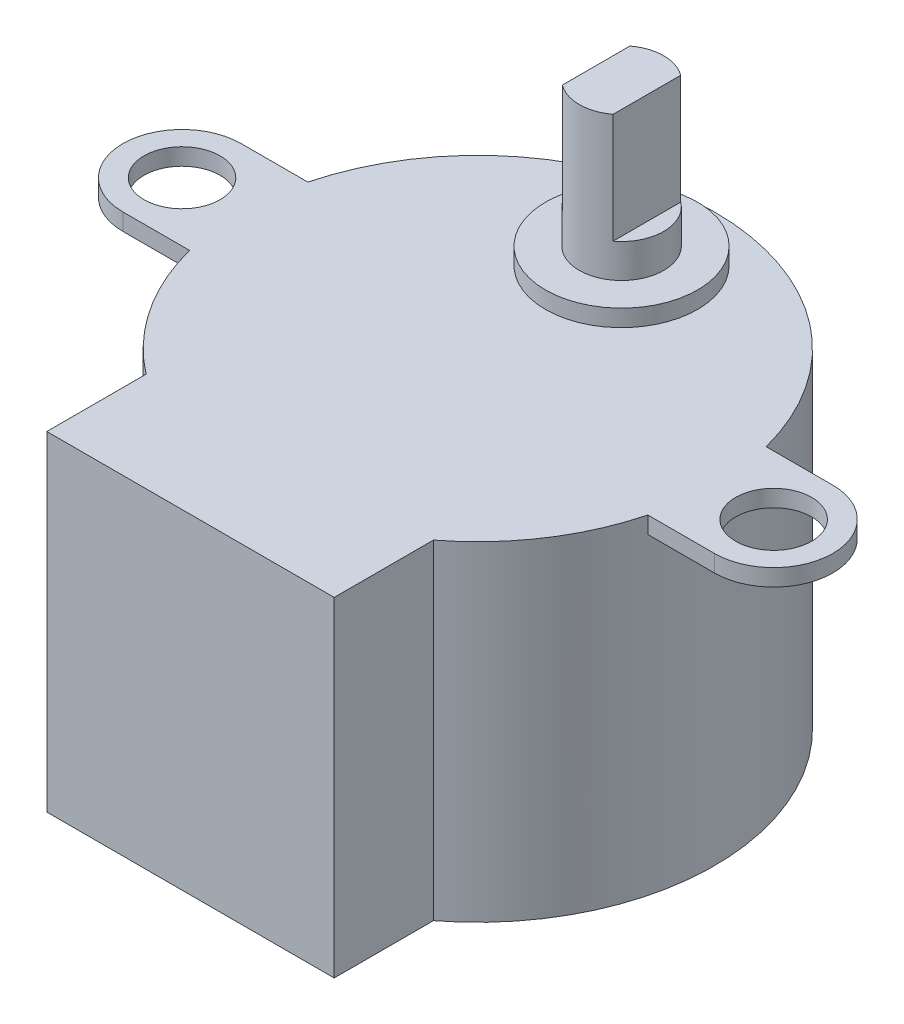
from build123d import *

# Parameters (mm, degrees)
BOSS_EXTRUDE1_DEPTH = 19.5
BOSS_EXTRUDE2_START = 18.5
SKETCH2_3_R         = 2.250000000000002
SKETCH2_3_R_2       = 2.249999999999999
BOSS_EXTRUDE2_DEPTH = 1
BOSS_EXTRUDE3_START = 19.5
SKETCH2_4_R         = 4.5
SKETCH2_4_R_2       = 2.5000000000000004
SKETCH2_4_W         = 3
SKETCH2_4_H         = 3.9999999999999973
BOSS_EXTRUDE3_DEPTH = 1
BOSS_EXTRUDE4_START = 20.5
SKETCH2_5_W         = 3
SKETCH2_5_H         = 3.9999999999999973
BOSS_EXTRUDE4_DEPTH = 2
BOSS_EXTRUDE5_START = 22.5
SKETCH2_6_W         = 3
SKETCH2_6_H         = 3.9999999999999973
BOSS_EXTRUDE5_DEPTH = 6.5


with BuildPart() as part:
    # Sketch2 → Boss-Extrude1 (new body)
    with BuildSketch(Plane(origin=(0, 0, 0), x_dir=(1, 0, 0), z_dir=(0, 1, 0))):
        with BuildLine():
            Line((-8.500000000000002, -17), (8.499999999999998, -17))
            Line((8.499999999999998, -17), (8.499999999999998, -11.124297730643494))
            ThreePointArc((8.5, -11.124297730643494), (0, 14), (-8.5, -11.124297730643493))
            Line((-8.500000000000002, -11.124297730643494), (-8.500000000000002, -17))
        make_face()
    extrude(amount=BOSS_EXTRUDE1_DEPTH)

    # Sketch2<3> → Boss-Extrude2 (add)
    # profile 1 of 2: a face of its own
    with BuildSketch(Plane(origin=(0, 0, 0), x_dir=(1, 0, 0), z_dir=(0, 1, 0)).offset(BOSS_EXTRUDE2_START)):
        with BuildLine():
            Line((13.555441711725987, -3.4999999999999996), (17.5, -3.499999999999999))
            ThreePointArc((17.5, -3.5), (21, -2.4e-16), (17.5, 3.5))
            Line((17.5, 3.499999999999999), (13.555441711725718, 3.4999999999999987))
            ThreePointArc((13.555441711725832, 3.5000000000004934), (13.999999999999998, 2.8244e-13), (13.555441711725974, -3.4999999999999454))
        make_face()
        with Locations(Location((17.5, -3e-17, 0), (0, 0, 270))):
            Circle(SKETCH2_3_R, mode=Mode.SUBTRACT)
    # profile 2 of 2: a face of its own
    with BuildSketch(Plane(origin=(0, 0, 0), x_dir=(1, 0, 0), z_dir=(0, 1, 0)).offset(BOSS_EXTRUDE2_START)):
        with BuildLine():
            Line((-17.499999999999986, -3.5000000000000044), (-13.555441711725983, -3.500000000000004))
            ThreePointArc((-13.555441711725972, -3.4999999999999547), (-14.000000000000002, 2.7667e-13), (-13.555441711725834, 3.50000000000049))
            Line((-13.55544171172572, 3.499999999999996), (-17.499999999999986, 3.4999999999999956))
            ThreePointArc((-17.499999999999986, 3.4999999999999956), (-20.999999999999986, -3.91e-15), (-17.499999999999986, -3.5000000000000044))
        make_face()
        with Locations(Location((-17.499999999999986, -4.34e-15, 0), (0, 0, 270))):
            Circle(SKETCH2_3_R_2, mode=Mode.SUBTRACT)
    extrude(amount=BOSS_EXTRUDE2_DEPTH)

    # Sketch2<4> → Boss-Extrude3 (add)
    # profile 1 of 6: a face of its own
    with BuildSketch(Plane(origin=(0, 0, 0), x_dir=(1, 0, 0), z_dir=(0, 1, 0)).offset(BOSS_EXTRUDE3_START)):
        with Locations(Location((0, 8.5, 0), (0, 0, 270))):
            Circle(SKETCH2_4_R)
        with Locations((0, 8.5)):
            Circle(SKETCH2_4_R_2, mode=Mode.SUBTRACT)
    # profile 2 of 6: a face of its own
    with BuildSketch(Plane(origin=(0, 0, 0), x_dir=(1, 0, 0), z_dir=(0, 1, 0)).offset(BOSS_EXTRUDE3_START)):
        with Locations((0, 8.5)):
            Circle(SKETCH2_4_R_2)
    # profile 3 of 6: a face of its own
    with BuildSketch(Plane(origin=(0, 0, 0), x_dir=(1, 0, 0), z_dir=(0, 1, 0)).offset(BOSS_EXTRUDE3_START)):
        with BuildLine():
            ThreePointArc((-1.5000000000000007, 10.5), (-2.5000000000000004, 8.5), (-1.5000000000000004, 6.5))
            Line((-1.5, 6.500000000000001), (-1.5, 10.499999999999998))
        make_face()
    # profile 4 of 6: a face of its own
    with BuildSketch(Plane(origin=(0, 0, 0), x_dir=(1, 0, 0), z_dir=(0, 1, 0)).offset(BOSS_EXTRUDE3_START)):
        with BuildLine():
            Line((-1.5, 10.499999999999998), (1.5, 10.499999999999998))
            ThreePointArc((1.500000000000001, 10.5), (1.5e-16, 11), (-1.5000000000000007, 10.5))
        make_face()
    # profile 5 of 6: a face of its own
    with BuildSketch(Plane(origin=(0, 0, 0), x_dir=(1, 0, 0), z_dir=(0, 1, 0)).offset(BOSS_EXTRUDE3_START)):
        with Locations((0, 8.5)):
            Rectangle(SKETCH2_4_W, SKETCH2_4_H)
    # profile 6 of 6: a face of its own
    with BuildSketch(Plane(origin=(0, 0, 0), x_dir=(1, 0, 0), z_dir=(0, 1, 0)).offset(BOSS_EXTRUDE3_START)):
        with BuildLine():
            ThreePointArc((-1.5000000000000004, 6.5), (-4.6e-16, 6), (1.4999999999999996, 6.499999999999999))
            Line((1.5, 6.500000000000001), (-1.5, 6.500000000000001))
        make_face()
    extrude(amount=BOSS_EXTRUDE3_DEPTH)

    # Sketch2<5> → Boss-Extrude4 (add)
    with BuildSketch(Plane(origin=(0, 0, 0), x_dir=(1, 0, 0), z_dir=(0, 1, 0)).offset(BOSS_EXTRUDE4_START)):
        with BuildLine():
            ThreePointArc((-1.5000000000000004, 6.5), (-4.6e-16, 6), (1.4999999999999996, 6.499999999999999))
            Line((1.5, 6.500000000000001), (-1.5, 6.500000000000001))
        make_face()
        with Locations((0, 8.5)):
            Rectangle(SKETCH2_5_W, SKETCH2_5_H)
        with BuildLine():
            Line((1.5, 10.499999999999998), (1.5, 6.500000000000001))
            ThreePointArc((1.4999999999999996, 6.499999999999999), (2.23606797749979, 7.381966011250104), (2.5000000000000004, 8.5))
            ThreePointArc((2.5000000000000004, 8.5), (2.2360679774997902, 9.618033988749895), (1.5000000000000013, 10.5))
        make_face()
        with BuildLine():
            ThreePointArc((-1.5000000000000007, 10.5), (-2.5000000000000004, 8.5), (-1.5000000000000004, 6.5))
            Line((-1.5, 6.500000000000001), (-1.5, 10.499999999999998))
        make_face()
        with BuildLine():
            Line((-1.5, 10.499999999999998), (1.5, 10.499999999999998))
            ThreePointArc((1.500000000000001, 10.5), (1.5e-16, 11), (-1.5000000000000007, 10.5))
        make_face()
    extrude(amount=BOSS_EXTRUDE4_DEPTH)

    # Sketch2<6> → Boss-Extrude5 (add)
    with BuildSketch(Plane(origin=(0, 0, 0), x_dir=(1, 0, 0), z_dir=(0, 1, 0)).offset(BOSS_EXTRUDE5_START)):
        with BuildLine():
            ThreePointArc((-1.5000000000000004, 6.5), (-4.6e-16, 6), (1.4999999999999996, 6.499999999999999))
            Line((1.5, 6.500000000000001), (-1.5, 6.500000000000001))
        make_face()
        with Locations((0, 8.5)):
            Rectangle(SKETCH2_6_W, SKETCH2_6_H)
        with BuildLine():
            Line((-1.5, 10.499999999999998), (1.5, 10.499999999999998))
            ThreePointArc((1.500000000000001, 10.5), (1.5e-16, 11), (-1.5000000000000007, 10.5))
        make_face()
    extrude(amount=BOSS_EXTRUDE5_DEPTH)


solid = part.part
